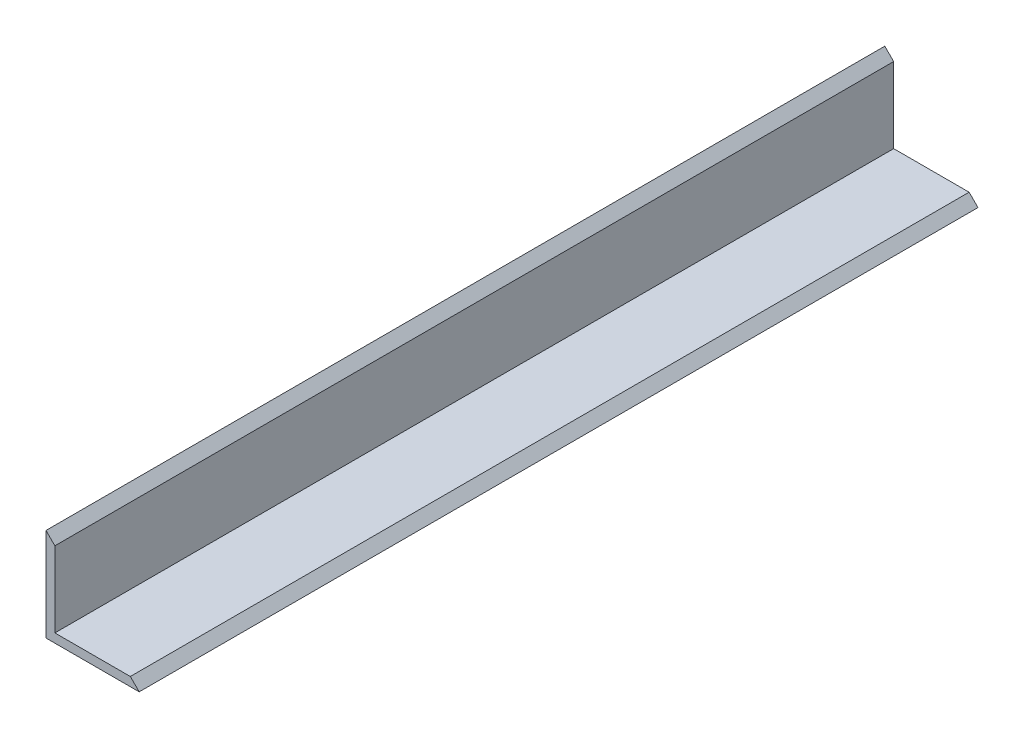
from build123d import *

# Parameters (mm, degrees)
BOSS_EXTRUDE1_DEPTH = 945
CUT_EXTRUDE1_DEPTH  = 956.523416772


with BuildPart() as part:
    # Sketch1 → Boss-Extrude1 (new body)
    with BuildSketch(Plane.XY):
        Polygon((-5, 100), (-5, -5), (100, -5), (100, 5), (5, 5), (5, 100), align=None)
    extrude(amount=BOSS_EXTRUDE1_DEPTH)

    # Sketch2 → Cut-Extrude1 (cut, through all)
    with BuildSketch(Plane.XY.offset(945)):
        Polygon((-5, 100), (100, -5), (100, 5), (5, 100), align=None)
    extrude(amount=-CUT_EXTRUDE1_DEPTH, mode=Mode.SUBTRACT)


solid = part.part
